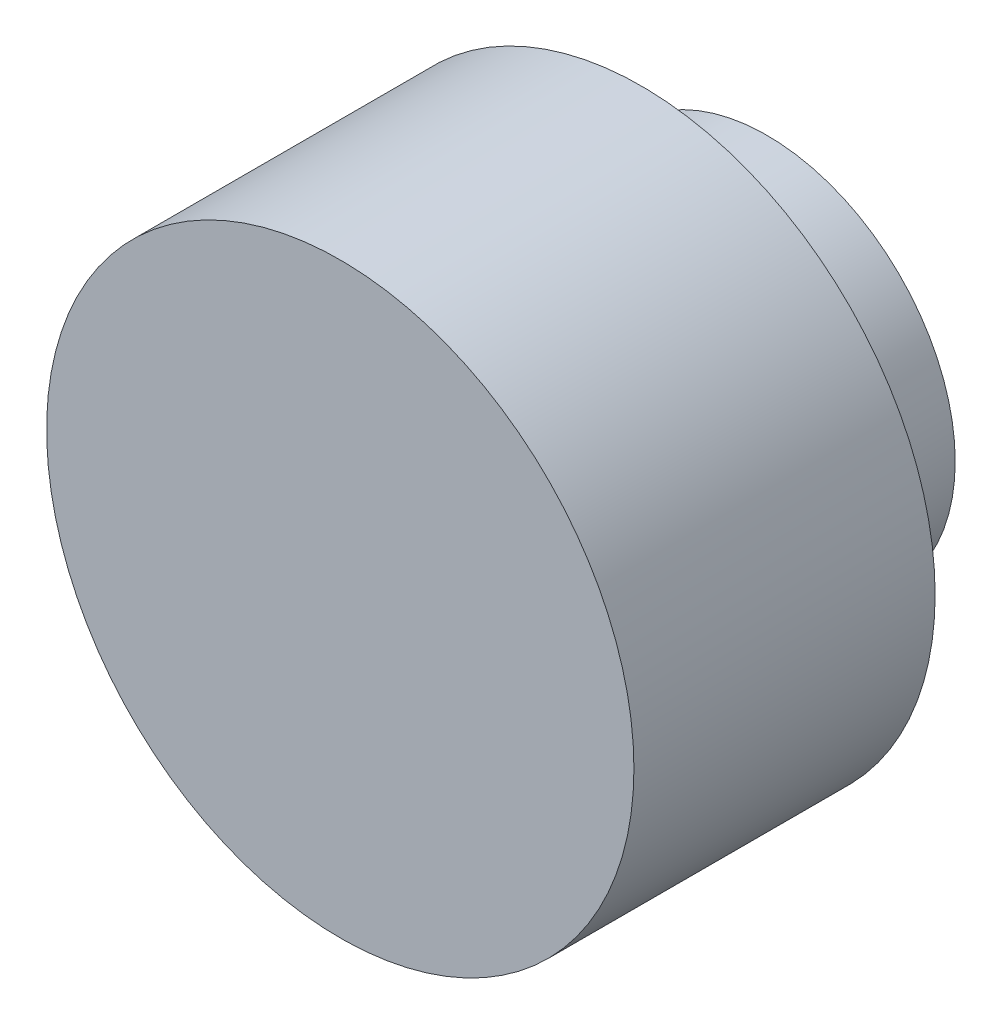
from build123d import *

# Parameters (mm, degrees)
SKETCH1_R           = 2.925
BOSS_EXTRUDE1_DEPTH = 3
SKETCH1_3_R         = 1.875
BOSS_EXTRUDE2_DEPTH = 1.25


with BuildPart() as part:
    # Sketch1 → Boss-Extrude1 (new body)
    with BuildSketch(Plane.XY):
        with Locations((73.89198705, 7.918180442)):
            Circle(SKETCH1_R)
    extrude(amount=BOSS_EXTRUDE1_DEPTH)

    # Sketch1<3> → Boss-Extrude2 (add)
    with BuildSketch(Plane.XY):
        with Locations((73.89198705, 7.918180442)):
            Circle(SKETCH1_3_R)
    extrude(amount=-BOSS_EXTRUDE2_DEPTH)


solid = part.part
